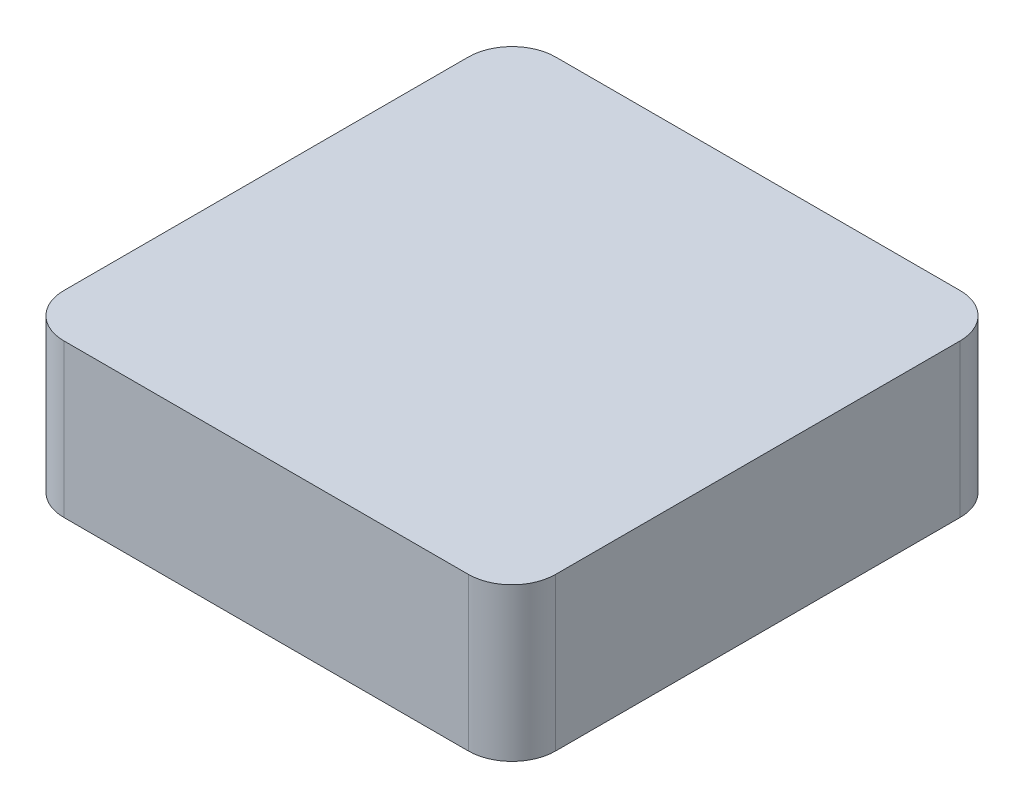
from build123d import *

# Parameters (mm, degrees)
SKETCH1_W           = 45
SKETCH1_H           = 45
BOSS_EXTRUDE1_DEPTH = 7
FILLET1_R           = 4


with BuildPart() as part:
    # Sketch1 → Boss-Extrude1 (new, symmetric)
    with BuildSketch(Plane(origin=(0, 0, 0), x_dir=(1, 0, 0), z_dir=(0, 1, 0))):
        Rectangle(SKETCH1_W, SKETCH1_H)
    extrude(amount=BOSS_EXTRUDE1_DEPTH, both=True)

    # Fillet1
    fillet1_edges = [part.edges().sort_by_distance(p)[0] for p in [
        (22.5, 0, 22.5),
        (-22.5, 0, 22.5),
        (-22.5, 0, -22.5),
        (22.5, 0, -22.5),
    ]]
    fillet(fillet1_edges, radius=FILLET1_R)


solid = part.part
